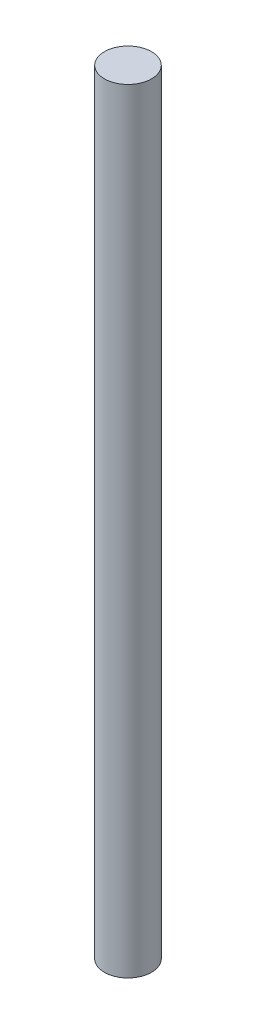
from build123d import *

# Parameters (mm, degrees)
SKETCH1_R           = 5.026321837
BOSS_EXTRUDE1_DEPTH = 165.1


with BuildPart() as part:
    # Sketch1 → Boss-Extrude1 (new body)
    with BuildSketch(Plane(origin=(0, 0, 0), x_dir=(1, 0, 0), z_dir=(0, 1, 0))):
        with Locations(Location((0, 0, 0), (0, 0, 270))):
            Circle(SKETCH1_R)
    extrude(amount=BOSS_EXTRUDE1_DEPTH)


solid = part.part
